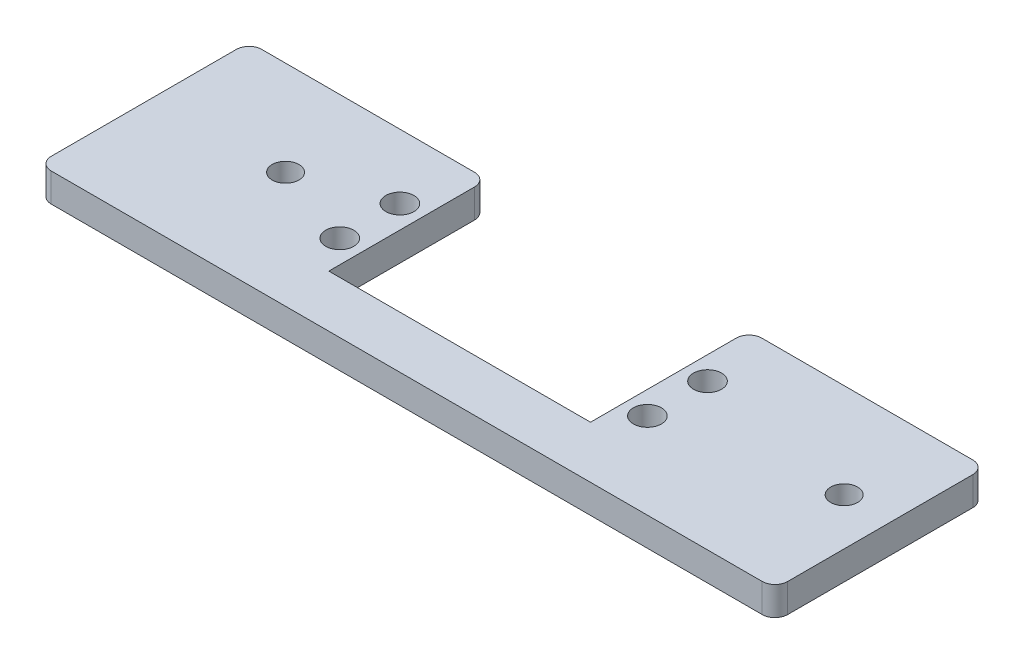
from build123d import *

# Parameters (mm, degrees)
SKETCH1_R           = 2.1082
SKETCH1_R_2         = 2.2
BOSS_EXTRUDE1_DEPTH = 4.5


with BuildPart() as part:
    # Sketch1 → Boss-Extrude1 (new body)
    with BuildSketch(Plane(origin=(0, 0, 0), x_dir=(1, 0, 0), z_dir=(0, 1, 0))):
        with BuildLine():
            Line((55.75, 16.51), (22.65807516, 16.51))
            ThreePointArc((22.65807516, 16.51), (21.243861598, 15.924213562), (20.65807516, 14.51))
            Line((20.65807516, 14.51), (20.65807516, -8.345000078))
            Line((20.65807516, -8.345000078), (-20.38832484, -8.345000078))
            Line((-20.38832484, -8.345000078), (-20.38832484, 14.51))
            ThreePointArc((-20.38832484, 14.51), (-20.974111278, 15.924213562), (-22.38832484, 16.51))
            Line((-22.38832484, 16.51), (-55.75, 16.51))
            ThreePointArc((-55.75, 16.51), (-57.164213562, 15.924213562), (-57.75, 14.51))
            Line((-57.75, 14.51), (-57.75, -14.51))
            ThreePointArc((-57.75, -14.51), (-57.164213562, -15.924213562), (-55.75, -16.51))
            Line((-55.75, -16.51), (55.75, -16.51))
            ThreePointArc((55.75, -16.51), (57.164213562, -15.924213562), (57.75, -14.51))
            Line((57.75, -14.51), (57.75, 14.51))
            ThreePointArc((57.75, 14.51), (57.164213562, 15.924213562), (55.75, 16.51))
        make_face()
        with Locations(Location((-37.20312484, 1.689999922, 0), (0, 0, 270))):
            Circle(SKETCH1_R, mode=Mode.SUBTRACT)
        with Locations(Location((50.40147516, 1.689999922, 0), (0, 0, 90))):
            Circle(SKETCH1_R, mode=Mode.SUBTRACT)
        with Locations(Location((-23.988324752, 6.404999922, 0), (0, 0, 270))):
            Circle(SKETCH1_R_2, mode=Mode.SUBTRACT)
        with Locations(Location((24.258075072, 6.404999922, 0), (0, 0, 90))):
            Circle(SKETCH1_R_2, mode=Mode.SUBTRACT)
        with Locations(Location((24.258075072, -3.025000078, 0), (0, 0, 270))):
            Circle(SKETCH1_R_2, mode=Mode.SUBTRACT)
        with Locations(Location((-23.988324752, -3.025000078, 0), (0, 0, 90))):
            Circle(SKETCH1_R_2, mode=Mode.SUBTRACT)
    extrude(amount=BOSS_EXTRUDE1_DEPTH)


solid = part.part
